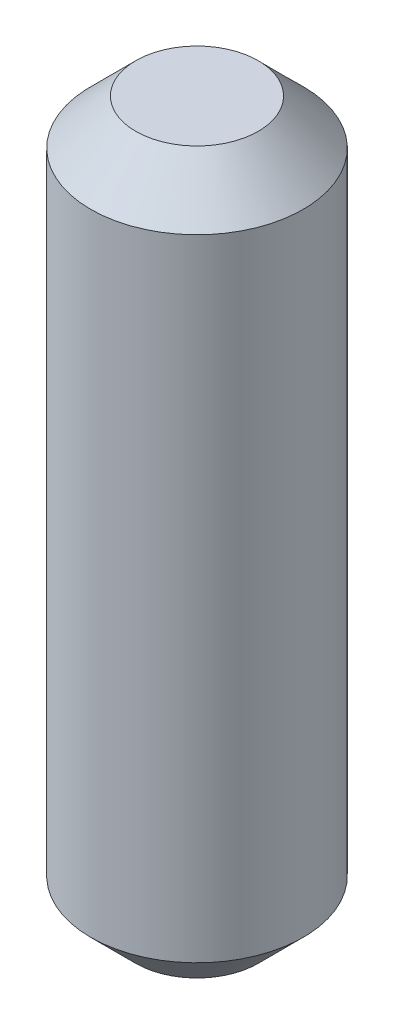
from build123d import *

# Parameters (mm, degrees)
SKETCH2_R           = 2.9972
BOSS_EXTRUDE1_DEPTH = 20.32
CHAMFER1_SIZE       = 1.27


with BuildPart() as part:
    # Sketch2 → Boss-Extrude1 (new body)
    with BuildSketch(Plane(origin=(0, 0, 0), x_dir=(1, 0, 0), z_dir=(0, 1, 0))):
        with Locations(Location((0, 0, 0), (0, 0, 270))):
            Circle(SKETCH2_R)
    extrude(amount=BOSS_EXTRUDE1_DEPTH)

    # Chamfer1
    chamfer1_edges = [part.edges().sort_by_distance(p)[0] for p in [
        (0, 0, -2.9972),
        (0, 20.32, -2.9972),
    ]]
    chamfer(chamfer1_edges, length=CHAMFER1_SIZE)


solid = part.part
